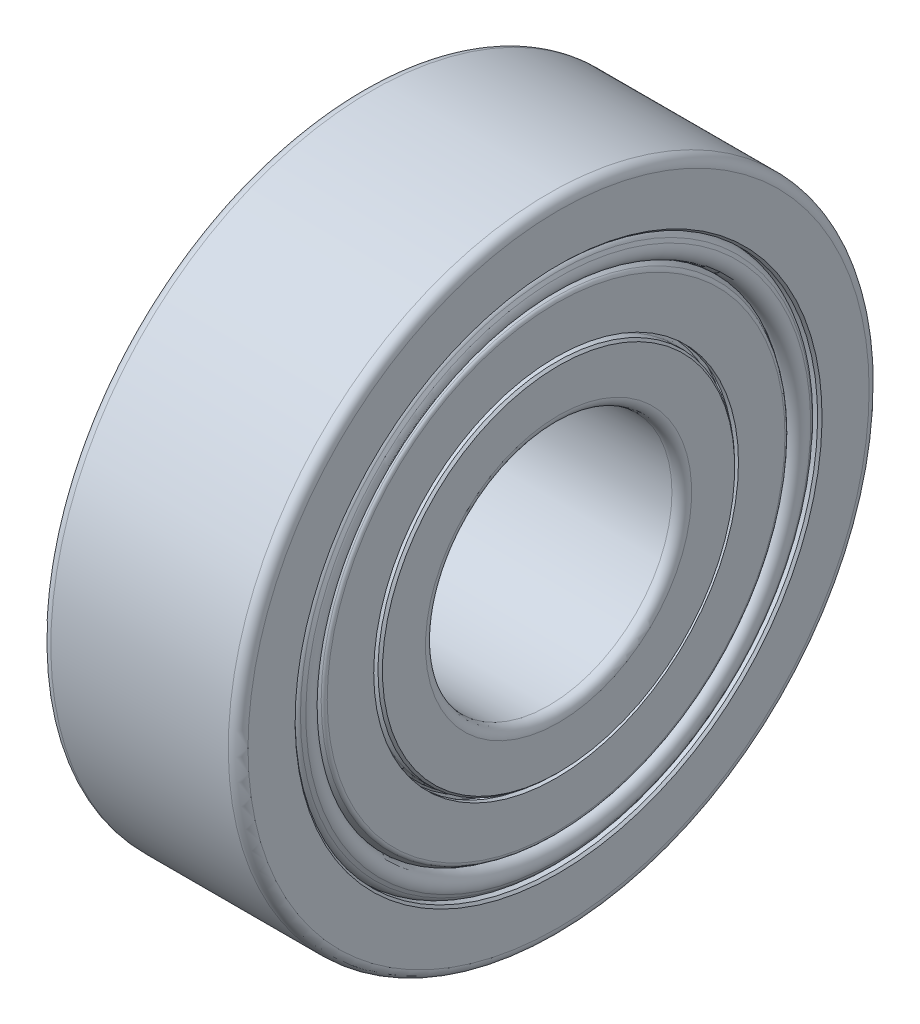
from build123d import *


with BuildPart() as part:
    # Sketch3 → Revolve1 (revolve)
    with BuildSketch(Plane.XY, mode=Mode.PRIVATE) as revolve1_sk:
        with BuildLine():
            Line((-1.8, 6.5), (1.8, 6.5))
            ThreePointArc((1.8, 6.5), (1.941421356, 6.441421356), (2, 6.3))
            Line((2, 6.3), (2, 5.345))
            Line((2, 5.345), (1.955, 5.3))
            Line((1.955, 5.3), (1.7, 5.3))
            Line((1.7, 5.3), (1.7, 5.372))
            Line((1.7, 5.372), (-1.7, 5.372))
            Line((-1.7, 5.372), (-1.7, 5.3))
            Line((-1.7, 5.3), (-1.955, 5.3))
            Line((-1.955, 5.3), (-2, 5.345))
            Line((-2, 5.345), (-2, 6.3))
            ThreePointArc((-2, 6.3), (-1.941421356, 6.441421356), (-1.8, 6.5))
        make_face()
        with BuildLine():
            Line((-1.955, 3.6184375), (-2, 3.5734375))
            Line((-2, 3.5734375), (-2, 2.7))
            ThreePointArc((-2, 2.7), (-1.941421356, 2.558578644), (-1.8, 2.5))
            Line((-1.8, 2.5), (1.8, 2.5))
            ThreePointArc((1.8, 2.5), (1.941421356, 2.558578644), (2, 2.7))
            Line((2, 2.7), (2, 3.5734375))
            Line((2, 3.5734375), (1.955, 3.6184375))
            Line((1.955, 3.6184375), (1.7890625, 3.6184375))
            ThreePointArc((1.7890625, 3.6184375), (1.713778857, 3.640594347), (1.6625, 3.7))
            Line((1.6625, 3.7), (1.6625, 3.772))
            Line((1.6625, 3.772), (-1.6625, 3.772))
            Line((-1.6625, 3.772), (-1.6625, 3.7))
            ThreePointArc((-1.6625, 3.7), (-1.713778857, 3.640594347), (-1.7890625, 3.6184375))
            Line((-1.7890625, 3.6184375), (-1.955, 3.6184375))
        make_face()
    revolve(revolve1_sk.sketch.rotate(Axis((-1.8, 0, 0), (1, 0, 0)), 180), axis=Axis((-1.8, 0, 0), (1, 0, 0)))


with BuildPart() as body_2:
    # Sketch4 → Revolve-Thin1 (revolve)
    with BuildSketch(Plane.XY, mode=Mode.PRIVATE) as revolve_thin1_sk:
        with BuildLine():
            ThreePointArc((1.803333333, 4.890717968), (1.907256382, 4.950717968), (1.907256382, 5.070717968))
            Line((1.907256382, 5.070717968), (1.867256382, 5.14))
            ThreePointArc((1.867256382, 5.14), (1.732275048, 5.195911099), (1.643333333, 5.08))
            Line((1.643333333, 5.08), (1.643333333, 4.883700908))
            ThreePointArc((1.643333333, 4.883700908), (1.646012825, 4.873700908), (1.653333333, 4.8663804))
            Line((1.653333333, 4.8663804), (1.905, 4.721080583))
            ThreePointArc((1.905, 4.721080583), (1.937942286, 4.688138296), (1.95, 4.643138296))
            Line((1.95, 4.643138296), (1.95, 3.7))
            Line((1.95, 3.7), (1.85, 3.7))
            Line((1.85, 3.7), (1.85, 4.637364794))
            Line((1.85, 4.637364794), (1.603333333, 4.77977786))
            ThreePointArc((1.603333333, 4.77977786), (1.559410285, 4.823700908), (1.543333333, 4.883700908))
            Line((1.543333333, 4.883700908), (1.543333333, 5.08))
            ThreePointArc((1.543333333, 5.08), (1.706393143, 5.292503682), (1.953858922, 5.19))
            Line((1.953858922, 5.19), (1.993858922, 5.120717968))
            ThreePointArc((1.993858922, 5.120717968), (1.993858922, 4.900717968), (1.803333333, 4.790717968))
            Line((1.803333333, 4.790717968), (1.803333333, 4.890717968))
        make_face()
    revolve(revolve_thin1_sk.sketch.rotate(Axis((-1.8, 0, 0), (1, 0, 0)), 180), axis=Axis((-1.8, 0, 0), (1, 0, 0)))


with BuildPart() as body_3:
    # Mirror2: mirrored copy
    add(body_2.part.mirror(Plane(origin=(0, 0, 0), x_dir=(0, 0, 1), z_dir=(1, 0, 0))))


with BuildPart() as body_3_2:
    # Mirror1: mirrored copy
    add(body_2.part.mirror(Plane(origin=(0, 0, 0), x_dir=(0, 0, 1), z_dir=(1, 0, 0))))


solid = Compound([part.part, body_2.part, body_3_2.part])
